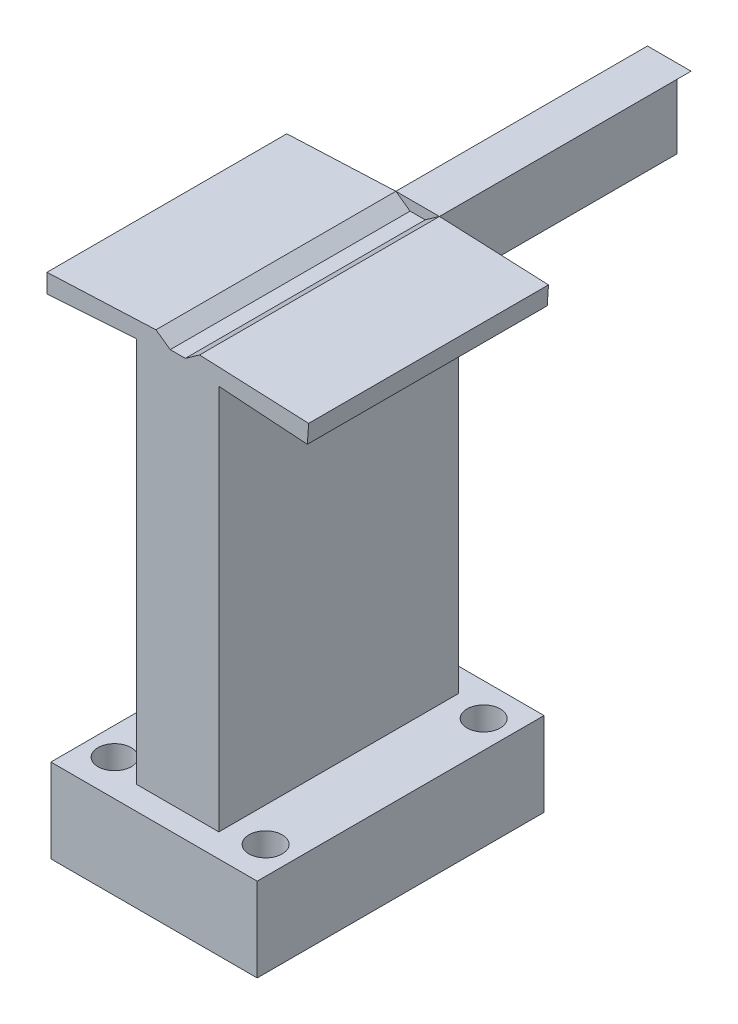
from build123d import *

# Parameters (mm, degrees)
SALIENTE_EXTRUIR1_DEPTH = 38.1
SALIENTE_EXTRUIR2_DEPTH = 36.322
CROQUIS5_W              = 31.242
CROQUIS5_H              = 43.434
SALIENTE_EXTRUIR3_DEPTH = 12.7
CROQUIS6_R              = 2.5146
CORTAR_EXTRUIR6_DEPTH   = 13.97


with BuildPart() as part:
    # Croquis2 → Saliente-Extruir1 (new body)
    with BuildSketch(Plane.XY):
        Polygon((0, 0), (0, 10.414), (2.159, 11.938), (-4.445, 11.938), (-2.286, 10.414), (-2.286, 0), align=None)
    extrude(amount=SALIENTE_EXTRUIR1_DEPTH)


with BuildPart() as body_2:
    # Croquis3 → Saliente-Extruir2 (new body)
    with BuildSketch(Plane.XY.offset(38.1)):
        Polygon((-7.366, -49.142919253), (-7.366, 9.189032695), (-7.456229251, 9.277080747), (-20.955, 8.369352225), (-20.955, 11.222937646), (-4.445, 11.938), (-2.286, 10.414), (0, 10.414), (2.159, 11.938), (18.669, 11.222937646), (18.477973677, 8.382197842), (5.170229251, 9.277080747), (5.08, 9.277080747), (5.08, -49.142919253), align=None)
    extrude(amount=SALIENTE_EXTRUIR2_DEPTH)

    # Croquis5 → Saliente-Extruir3 (add)
    with BuildSketch(Plane.XZ.offset(49.142919253)):
        with Locations((-1.179770749, 56.261)):
            Rectangle(CROQUIS5_W, CROQUIS5_H)
    extrude(amount=SALIENTE_EXTRUIR3_DEPTH)

    # Croquis6 → Cortar-Extruir6 (cut)
    with BuildSketch(Plane.XZ.offset(61.842919253)):
        with Locations(Location((-12.609770351, 72.517, 0), (0, 0, 270))):
            Circle(CROQUIS6_R)
        with Locations(Location((10.250229251, 72.517, 0), (0, 0, 270))):
            Circle(CROQUIS6_R)
        with Locations(Location((10.250229251, 39.501266304, 0), (0, 0, 270))):
            Circle(CROQUIS6_R)
        with Locations(Location((-12.609770351, 39.501266304, 0), (0, 0, 270))):
            Circle(CROQUIS6_R)
    extrude(amount=-CORTAR_EXTRUIR6_DEPTH, mode=Mode.SUBTRACT)


solid = Compound([part.part, body_2.part])
